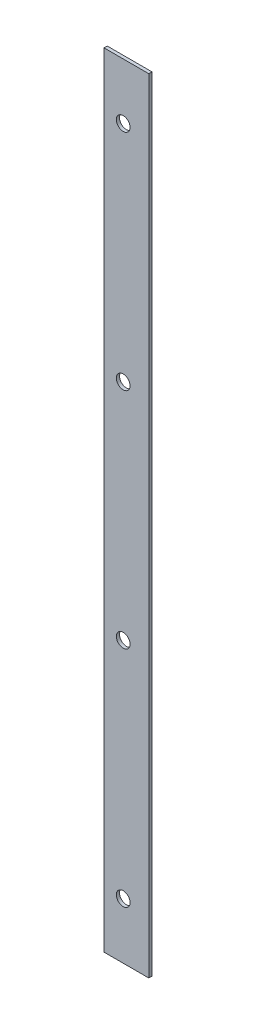
from build123d import *

# Parameters (mm, degrees)
SKETCH_1_W      = 14
SKETCH_1_H      = 245
SKETCH_1_R      = 2.15
EXTRUDE_1_DEPTH = 1


with BuildPart() as part:
    # Эскиз1 → Вытянуть1 (new body)
    with BuildSketch(Plane.XY):
        with Locations((1, 0)):
            Rectangle(SKETCH_1_W, SKETCH_1_H)
        with Locations((0, -105)):
            Circle(SKETCH_1_R, mode=Mode.SUBTRACT)
        with Locations((0, -35)):
            Circle(SKETCH_1_R, mode=Mode.SUBTRACT)
        with Locations((0, 35)):
            Circle(SKETCH_1_R, mode=Mode.SUBTRACT)
        with Locations((0, 105)):
            Circle(SKETCH_1_R, mode=Mode.SUBTRACT)
    extrude(amount=EXTRUDE_1_DEPTH)


solid = part.part
